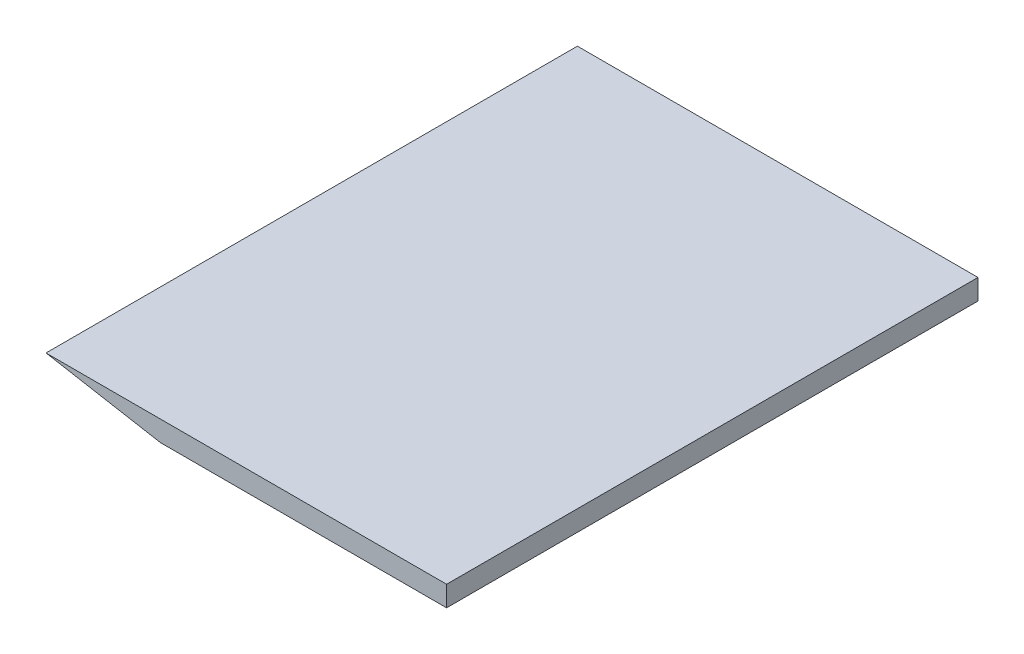
from build123d import *

# Parameters (mm, degrees)
BOSS_EXTRUDE1_DEPTH = 130


with BuildPart() as part:
    # Sketch1 → Boss-Extrude1 (new body)
    with BuildSketch(Plane.XY):
        Polygon((0, 0), (98, 0), (98, -5), (28, -5), align=None)
    extrude(amount=BOSS_EXTRUDE1_DEPTH)


solid = part.part
